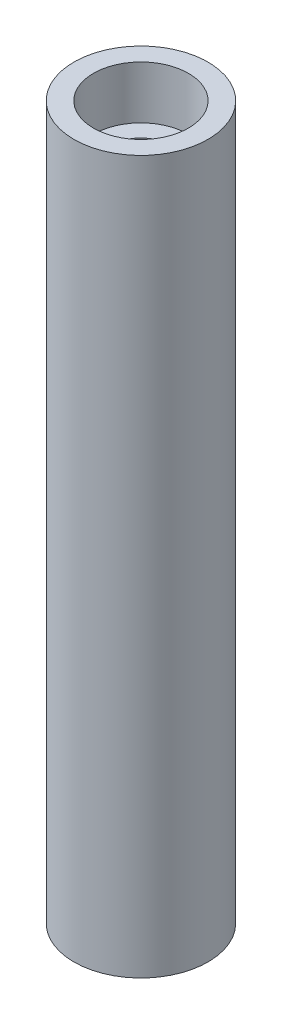
from build123d import *

# Parameters (mm, degrees)
SKETCH1_R                       = 12.7
BOSS_EXTRUDE1_DEPTH             = 135
CBORE_FOR_M10_SHCS1_D           = 11
CBORE_FOR_M10_SHCS1_CBORE_D     = 18
CBORE_FOR_M10_SHCS1_CBORE_DEPTH = 10


with BuildPart() as part:
    # Sketch1 → Boss-Extrude1 (new body)
    with BuildSketch(Plane(origin=(0, 0, 0), x_dir=(1, 0, 0), z_dir=(0, 1, 0))):
        with Locations(Location((0, 0, 0), (0, 0, 270))):
            Circle(SKETCH1_R)
    extrude(amount=BOSS_EXTRUDE1_DEPTH)

    # CBORE for M10 SHCS1 (through all)
    with Locations(Plane(origin=(0, 135, 0), x_dir=(1, 0, 0), z_dir=(0, 1, 0))):
        with Locations((0, 0)):
            CounterBoreHole(CBORE_FOR_M10_SHCS1_D / 2, CBORE_FOR_M10_SHCS1_CBORE_D / 2, CBORE_FOR_M10_SHCS1_CBORE_DEPTH)


solid = part.part
